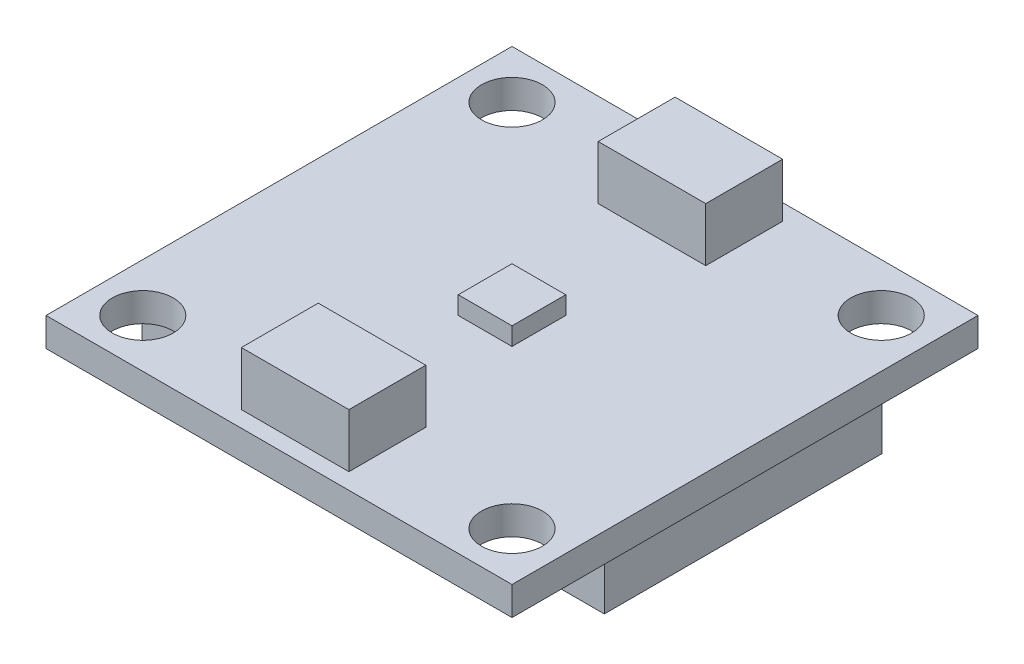
from build123d import *

# Parameters (mm, degrees)
SKETCH1_W           = 26
SKETCH1_H           = 26
SKETCH1_R           = 1.7
BOSS_EXTRUDE1_DEPTH = 1.6
SKETCH2_W           = 6
SKETCH2_H           = 4.29
BOSS_EXTRUDE2_DEPTH = 3
SKETCH3_W           = 2.5
SKETCH3_H           = 15.5
BOSS_EXTRUDE3_DEPTH = 2.5
SKETCH4_W           = 3
SKETCH4_H           = 3
BOSS_EXTRUDE4_DEPTH = 1


with BuildPart() as part:
    # Sketch1 → Boss-Extrude1 (new body)
    with BuildSketch(Plane(origin=(0, 0, 0), x_dir=(1, 0, 0), z_dir=(0, 1, 0))):
        Rectangle(SKETCH1_W, SKETCH1_H)
        with Locations(Location((-10.3, 10.3, 0), (0, 0, 270))):
            Circle(SKETCH1_R, mode=Mode.SUBTRACT)
        with Locations(Location((10.3, 10.3, 0), (0, 0, 270))):
            Circle(SKETCH1_R, mode=Mode.SUBTRACT)
        with Locations(Location((-10.3, -10.3, 0), (0, 0, 270))):
            Circle(SKETCH1_R, mode=Mode.SUBTRACT)
        with Locations(Location((10.3, -10.3, 0), (0, 0, 270))):
            Circle(SKETCH1_R, mode=Mode.SUBTRACT)
    extrude(amount=BOSS_EXTRUDE1_DEPTH)

    # Sketch2 → Boss-Extrude2 (add)
    with BuildSketch(Plane(origin=(0, 1.6, 0), x_dir=(1, 0, 0), z_dir=(0, 1, 0))):
        with Locations((0, 9.955)):
            Rectangle(SKETCH2_W, SKETCH2_H)
        with Locations((0, -9.955)):
            Rectangle(SKETCH2_W, SKETCH2_H)
    extrude(amount=BOSS_EXTRUDE2_DEPTH)

    # Sketch3 → Boss-Extrude3 (add)
    with BuildSketch(Plane.XZ):
        with Locations((-11.65, 0)):
            Rectangle(SKETCH3_W, SKETCH3_H)
        with Locations((11.65, 0)):
            Rectangle(SKETCH3_W, SKETCH3_H)
    extrude(amount=BOSS_EXTRUDE3_DEPTH)

    # Sketch4 → Boss-Extrude4 (add)
    with BuildSketch(Plane(origin=(0, 1.6, 0), x_dir=(1, 0, 0), z_dir=(0, 1, 0))):
        Rectangle(SKETCH4_W, SKETCH4_H)
    extrude(amount=BOSS_EXTRUDE4_DEPTH)


solid = part.part
